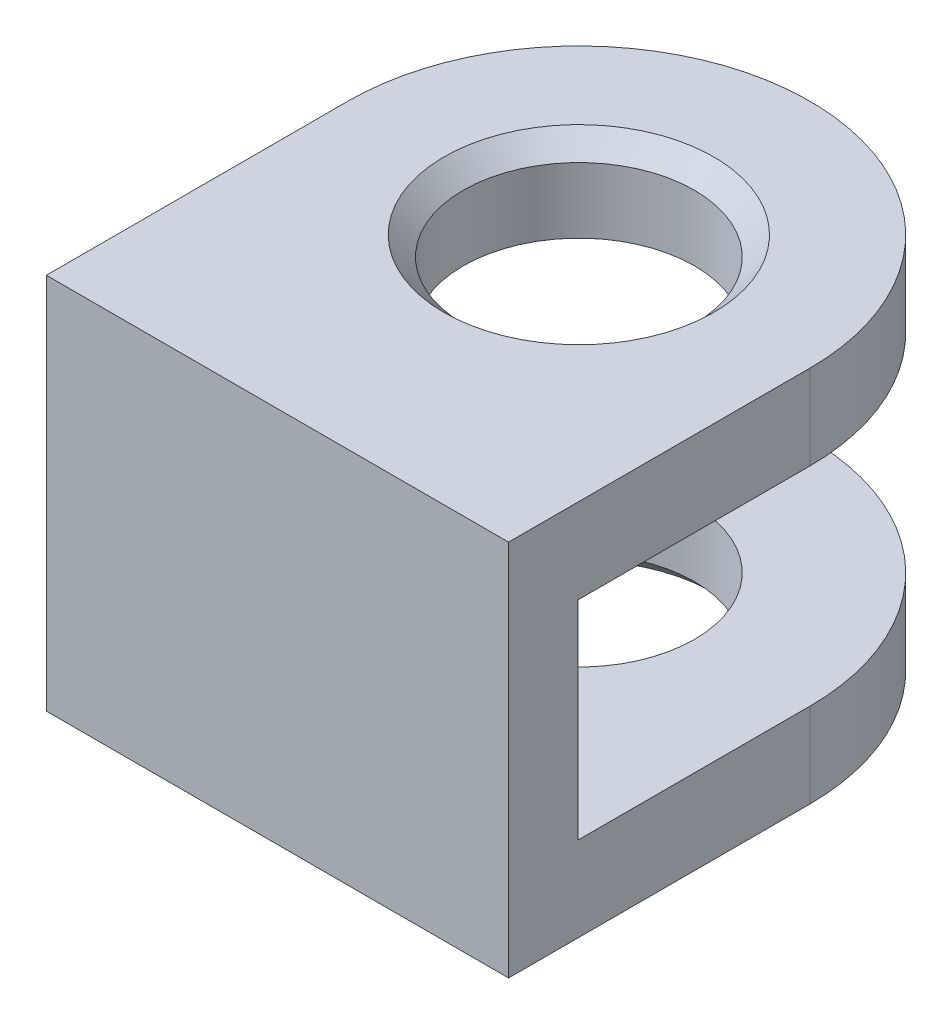
from build123d import *

# Parameters (mm, degrees)
SKETCH1_R           = 3
BOSS_EXTRUDE1_DEPTH = 4.9
CUT_EXTRUDE1_DEPTH  = 2.7
CHAMFER1_SIZE       = 0.5


with BuildPart() as part:
    # Sketch1 → Boss-Extrude1 (new, symmetric)
    with BuildSketch(Plane(origin=(0, 0, 0), x_dir=(1, 0, 0), z_dir=(0, 1, 0))):
        with BuildLine():
            Line((-6, 7.825), (-6, 0))
            Line((-6, 0), (6, 0))
            Line((6, 0), (6, 7.825))
            ThreePointArc((6, 7.825), (0, 13.825), (-6, 7.825))
        make_face()
        with Locations(Location((0, 7.825, 0), (0, 0, 270))):
            Circle(SKETCH1_R, mode=Mode.SUBTRACT)
    extrude(amount=BOSS_EXTRUDE1_DEPTH, both=True)

    # Sketch3 → Cut-Extrude1 (cut, symmetric)
    with BuildSketch(Plane(origin=(0, 0, 0), x_dir=(1, 0, 0), z_dir=(0, 1, 0))):
        with BuildLine():
            Line((6, 1.8), (-6, 1.8))
            Line((-6, 1.8), (-6, 7.825))
            ThreePointArc((-6, 7.825), (0, 13.825), (6, 7.825))
            Line((6, 7.825), (6, 1.8))
        make_face()
    extrude(amount=CUT_EXTRUDE1_DEPTH, both=True, mode=Mode.SUBTRACT)

    # Chamfer1
    chamfer1_edges = [part.edges().sort_by_distance(p)[0] for p in [
        (0, -4.9, -10.825),
        (0, 4.9, -10.825),
    ]]
    chamfer(chamfer1_edges, length=CHAMFER1_SIZE)


solid = part.part
